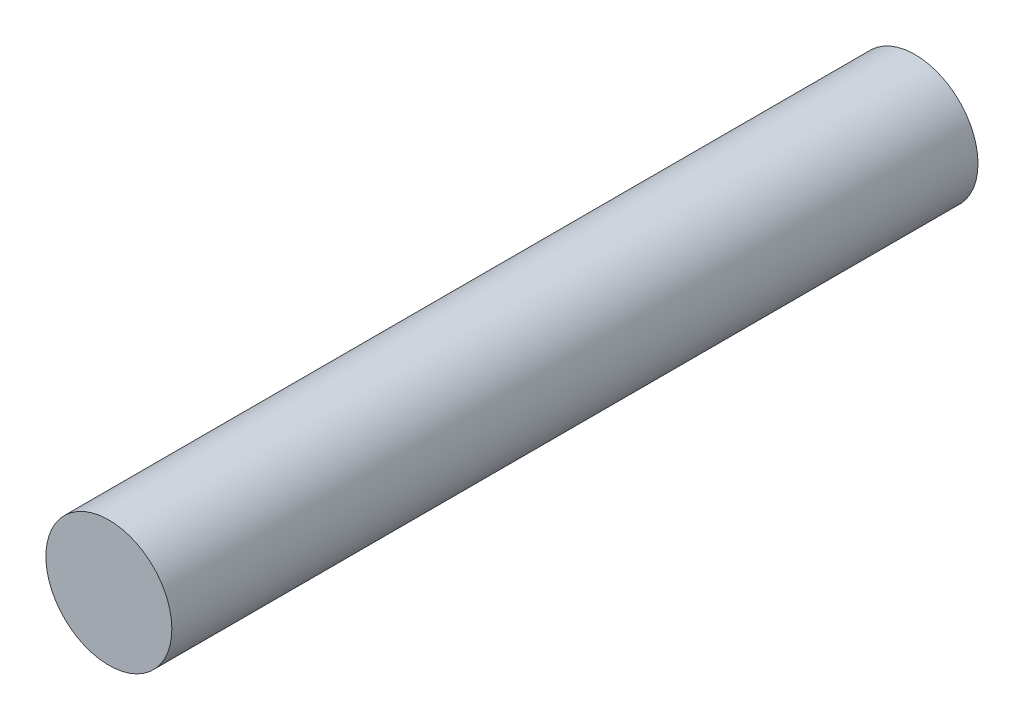
from build123d import *

# Parameters (mm, degrees)
ESQUISSE1_R         = 2.5
BOSS_EXTRUDE1_DEPTH = 16


with BuildPart() as part:
    # Esquisse1 → Boss-Extrude1 (new, symmetric)
    with BuildSketch(Plane.XY):
        Circle(ESQUISSE1_R)
    extrude(amount=BOSS_EXTRUDE1_DEPTH, both=True)


solid = part.part
